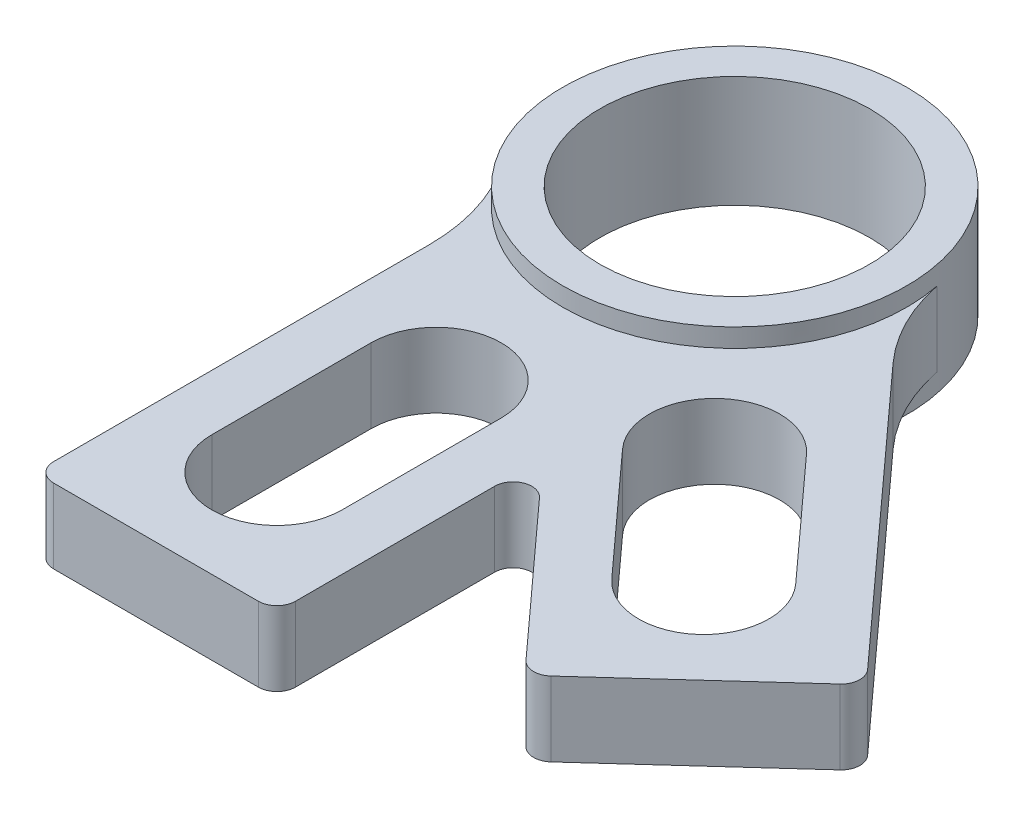
from build123d import *

# Parameters (mm, degrees)
SKETCH1_R                      = 14.681199999999999
SKETCH1_R_2                    = 11.5062
BEARING_INSERT_EXTRUDE_DEPTH   = 4.7625
APEX_SLOT_INSERT_EXTRUDE_DEPTH = 3.175
FILLET1_R                      = 16.002
FILLET2_R                      = 1.5875


with BuildPart() as part:
    # Sketch1 → Bearing_Insert_Extrude (new, symmetric)
    with BuildSketch(Plane(origin=(0, 0, 0), x_dir=(1, 0, 0), z_dir=(0, 1, 0))):
        with Locations(Location((0, 0, 0), (0, 0, 90))):
            Circle(SKETCH1_R)
        with Locations(Location((0, 0, 0), (0, 0, 90))):
            Circle(SKETCH1_R_2, mode=Mode.SUBTRACT)
    extrude(amount=BEARING_INSERT_EXTRUDE_DEPTH, both=True)

    # Sketch1<4> → Apex_Slot_Insert_Extrude (add, symmetric)
    with BuildSketch(Plane(origin=(0, 0, 0), x_dir=(1, 0, 0), z_dir=(0, 1, 0))):
        with BuildLine():
            Line((-10.318749999999993, -10.443228996699254), (-10.318749999999994, -49.390299999999996))
            Line((-10.318749999999994, -49.390299999999996), (10.318750000000005, -49.39029999999999))
            Line((10.318750000000005, -49.39029999999999), (10.318750000000005, -26.704691888242454))
            Line((10.318750000000003, -26.704691888242454), (25.572760300589366, -43.49611782976841))
            Line((25.572760300589366, -43.49611782976841), (40.84821825442049, -29.619274148630485))
            Line((40.84821825442049, -29.619274148630485), (14.659851632931186, -0.7914439591308806))
            ThreePointArc((14.659851632931188, -0.7914439591308853), (5.291552650188477, -13.694418716772292), (-10.318749999999994, -10.443228996699252))
        make_face()
        with BuildLine():
            ThreePointArc((5.556250000000003, -39.07155000000002), (3.51e-15, -44.62780000000001), (-5.556249999999994, -39.07155000000002))
            Line((-5.556249999999995, -39.07155000000002), (-5.556249999999993, -25.482550000000018))
            ThreePointArc((-5.556249999999995, -25.482550000000018), (4.34e-15, -19.92630000000002), (5.556250000000002, -25.482550000000018))
            Line((5.556250000000002, -25.482550000000018), (5.556250000000004, -39.07155000000002))
        make_face(mode=Mode.SUBTRACT)
        with BuildLine():
            ThreePointArc((30.384690732198205, -25.183893713515992), (30.00814073570387, -33.0325903075461), (22.159444141673756, -32.65604031105178))
            Line((22.159444141673756, -32.65604031105178), (13.022076302401407, -22.59773876606759))
            ThreePointArc((13.022076302401405, -22.59773876606759), (13.398626298895733, -14.749042172037479), (21.247322892925844, -15.125592168531803))
            Line((21.247322892925844, -15.125592168531803), (30.384690732198205, -25.18389371351599))
        make_face(mode=Mode.SUBTRACT)
    extrude(amount=APEX_SLOT_INSERT_EXTRUDE_DEPTH, both=True)

    # Fillet1
    fillet1_edges = [part.edges().sort_by_distance(p)[0] for p in [
        (14.659851632931186, 0, 0.791443959130883),
        (-10.318749999999994, 0, 10.443228996699252),
    ]]
    fillet(fillet1_edges, radius=FILLET1_R)

    # Fillet2
    fillet2_edges = [part.edges().sort_by_distance(p)[0] for p in [
        (-10.318749999999994, 0, 49.390299999999996),
        (10.318750000000005, 0, 49.39029999999999),
        (10.318750000000005, 0, 26.704691888242454),
        (25.572760300589366, 0, 43.49611782976841),
        (40.84821825442049, 0, 29.619274148630485),
    ]]
    fillet(fillet2_edges, radius=FILLET2_R)


solid = part.part
